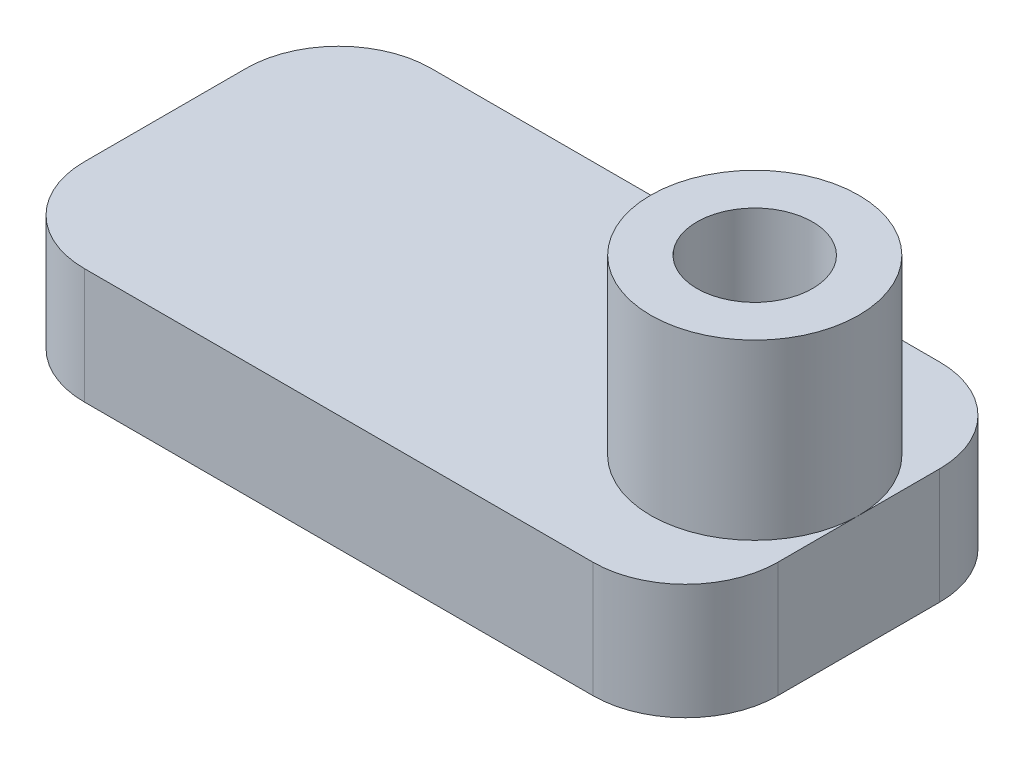
from build123d import *

# Parameters (mm, degrees)
SKETCH1_W           = 60
SKETCH1_H           = 30
SKETCH1_R           = 5
BOSS_EXTRUDE1_DEPTH = 10
FILLET1_R           = 8
SKETCH1_3_R         = 9
SKETCH1_3_R_2       = 5
BOSS_EXTRUDE2_DEPTH = 25


with BuildPart() as part:
    # Sketch1 → Boss-Extrude1 (new body)
    with BuildSketch(Plane(origin=(0, 0, 0), x_dir=(1, 0, 0), z_dir=(0, 1, 0))):
        with Locations((-21, 0)):
            Rectangle(SKETCH1_W, SKETCH1_H)
        Circle(SKETCH1_R, mode=Mode.SUBTRACT)
    extrude(amount=BOSS_EXTRUDE1_DEPTH)

    # Fillet1
    fillet1_edges = [part.edges().sort_by_distance(p)[0] for p in [
        (-51, 5, 15),
        (-51, 5, -15),
        (9, 5, -15),
        (9, 5, 15),
    ]]
    fillet(fillet1_edges, radius=FILLET1_R)

    # Sketch1<3> → Boss-Extrude2 (add)
    with BuildSketch(Plane(origin=(0, 0, 0), x_dir=(1, 0, 0), z_dir=(0, 1, 0))):
        Circle(SKETCH1_3_R)
        Circle(SKETCH1_3_R_2, mode=Mode.SUBTRACT)
    extrude(amount=BOSS_EXTRUDE2_DEPTH)


solid = part.part
